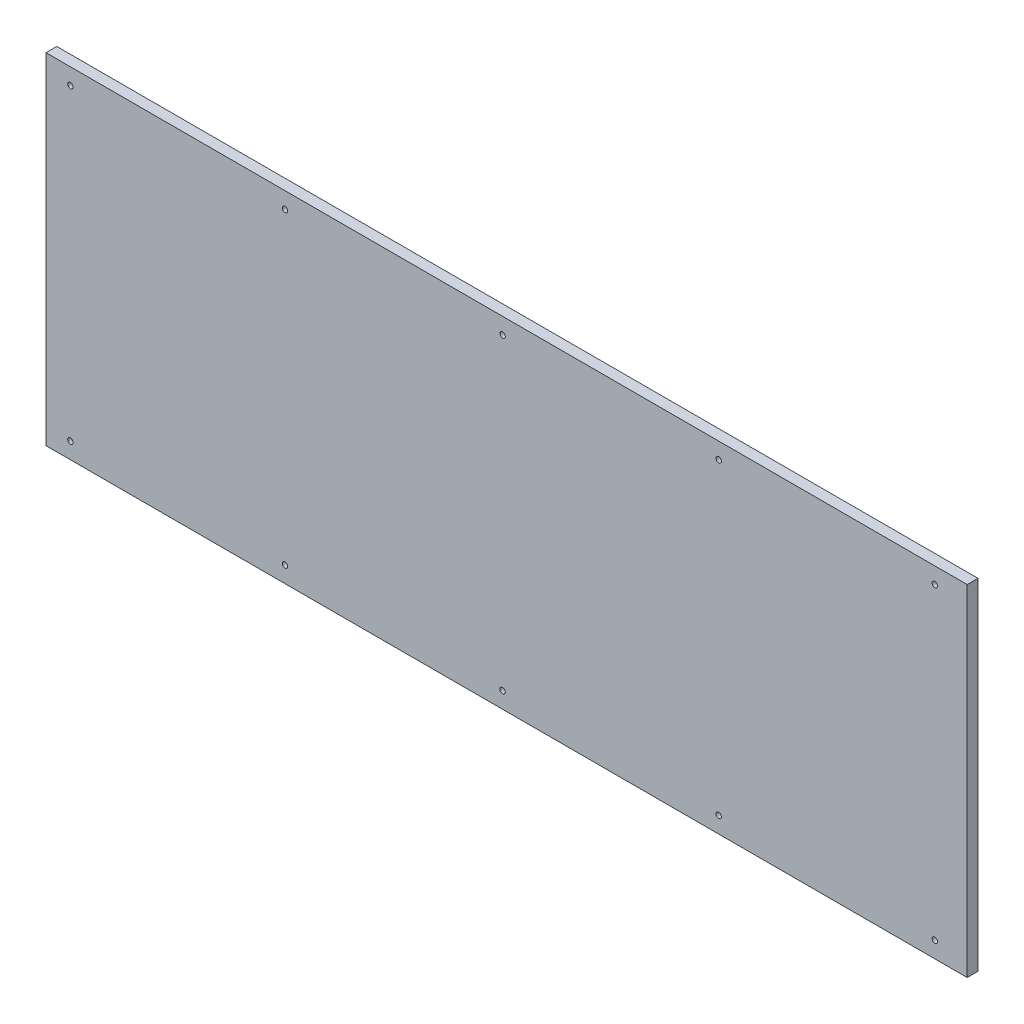
from build123d import *

# Parameters (mm, degrees)
SKETCH1_W           = 1082.802
SKETCH1_H           = 400.05
BOSS_EXTRUDE1_DEPTH = 12.7
SKETCH2_R           = 3.175
CUT_EXTRUDE1_DEPTH  = 1155.409573637


with BuildPart() as part:
    # Sketch1 → Boss-Extrude1 (new body)
    with BuildSketch(Plane.XY):
        with Locations((-541.401, 200.025)):
            Rectangle(SKETCH1_W, SKETCH1_H)
    extrude(amount=BOSS_EXTRUDE1_DEPTH)

    # Sketch2 (on Front Plane) → Cut-Extrude1 (cut, through all)
    with BuildSketch(Plane.XY):
        with Locations((-1054.1, 19.05)):
            Circle(SKETCH2_R)
        with Locations((-801.878, 19.05)):
            Circle(SKETCH2_R)
        with Locations((-546.1, 19.05)):
            Circle(SKETCH2_R)
        with Locations((-292.1, 19.05)):
            Circle(SKETCH2_R)
        with Locations((-38.1, 19.05)):
            Circle(SKETCH2_R)
        with Locations(Location((-38.1, 381, 0), (0, 0, 180))):
            Circle(SKETCH2_R)
        with Locations(Location((-292.1, 381, 0), (0, 0, 180))):
            Circle(SKETCH2_R)
        with Locations(Location((-546.1, 381, 0), (0, 0, 180))):
            Circle(SKETCH2_R)
        with Locations(Location((-801.878, 381, 0), (0, 0, 180))):
            Circle(SKETCH2_R)
        with Locations(Location((-1054.1, 381, 0), (0, 0, 180))):
            Circle(SKETCH2_R)
    extrude(amount=CUT_EXTRUDE1_DEPTH, mode=Mode.SUBTRACT)


solid = part.part
